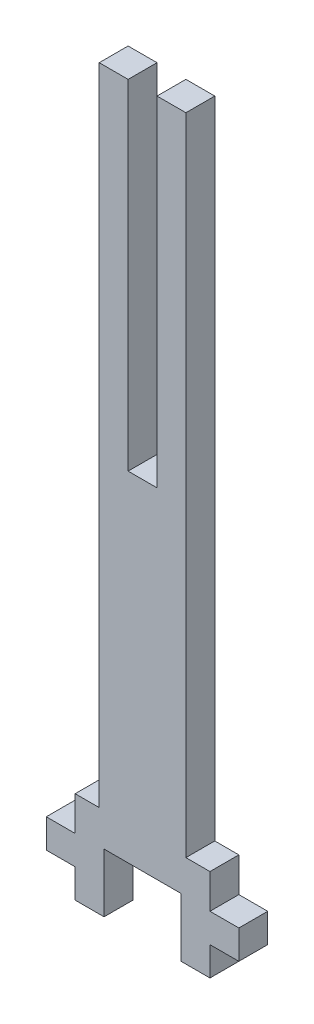
from build123d import *

# Parameters (mm, degrees)
EXTRUDE_1_DEPTH     = 3
SKETCH_2_W          = 3
SKETCH_2_H          = 35.233500033
CUT_EXTRUDE_1_DEPTH = 3
SKETCH_3_W          = 3
SKETCH_3_H          = 3
EXTRUDE_2_DEPTH     = 3


with BuildPart() as part:
    # 스케치1 → 보스-돌출1 (new body)
    with BuildSketch(Plane.XY):
        Polygon((-4.5, 38.283500033), (4.5, 38.283500033), (4.5, -28.708499937), (7, -28.708499937), (7, -38.283500033), (4, -38.283500033), (4, -32.183500033), (-4, -32.183500033), (-4, -38.283500033), (-7, -38.283500033), (-7, -28.708499937), (-4.5, -28.708499937), align=None)
    extrude(amount=EXTRUDE_1_DEPTH)

    # 스케치2 → 컷-돌출1 (cut)
    with BuildSketch(Plane.XY.offset(3)):
        with Locations((0, 20.666750016)):
            Rectangle(SKETCH_2_W, SKETCH_2_H)
    extrude(amount=-CUT_EXTRUDE_1_DEPTH, mode=Mode.SUBTRACT)

    # 스케치3 → 보스-돌출2 (add)
    with BuildSketch(Plane.XY.offset(3)):
        with Locations((-8.5, -33.783500033)):
            Rectangle(SKETCH_3_W, SKETCH_3_H)
        with Locations((8.5, -33.783500033)):
            Rectangle(SKETCH_3_W, SKETCH_3_H)
    extrude(amount=-EXTRUDE_2_DEPTH)


solid = part.part
